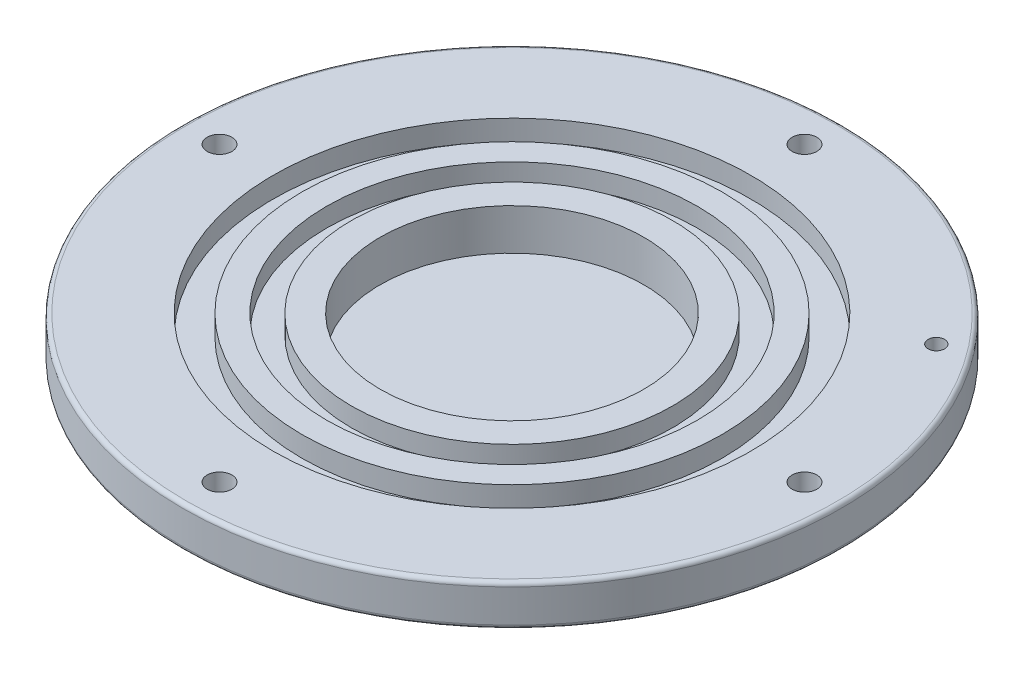
from build123d import *

# Parameters (mm, degrees)
SKETCH1_R            = 40
BOSS_EXTRUDE11_DEPTH = 5
SKETCH1_14_R         = 1.5
CUT_EXTRUDE5_DEPTH   = 57.789083458
OFFSETCIRCLE_R       = 22.5
BOSS_EXTRUDE14_DEPTH = 10
SKETCH1_15_R         = 22.5
SKETCH1_15_R_2       = 19.5
CUT_EXTRUDE6_DEPTH   = 2.3
SKETCH1_16_R         = 29
SKETCH1_16_R_2       = 25.5
CUT_EXTRUDE7_DEPTH   = 2.5
SKETCH10_R           = 1
CUT_EXTRUDE8_DEPTH   = 58.445626465
SKETCH1_17_R         = 16
CUT_EXTRUDE9_DEPTH   = 5
FILLET1_R            = 0.5
FILLET2_R            = 0.5
FILLET3_R            = 0.5


with BuildPart() as part:
    # Sketch1 → Boss-Extrude11 (new body)
    with BuildSketch(Plane(origin=(0, 0, 0), x_dir=(1, 0, 0), z_dir=(0, 1, 0))):
        Circle(SKETCH1_R)
    extrude(amount=-BOSS_EXTRUDE11_DEPTH)

    # Sketch1<14> → Cut-Extrude5 (cut, through all)
    with BuildSketch(Plane(origin=(0, 0, 0), x_dir=(1, 0, 0), z_dir=(0, 1, 0))):
        with Locations((35.5, 0)):
            Circle(SKETCH1_14_R)
        with Locations((0, -35.5)):
            Circle(SKETCH1_14_R)
        with Locations((-35.5, 0)):
            Circle(SKETCH1_14_R)
        with Locations((0, 35.5)):
            Circle(SKETCH1_14_R)
    extrude(amount=-CUT_EXTRUDE5_DEPTH, mode=Mode.SUBTRACT)

    # offsetCircle → Boss-Extrude14 (add)
    with BuildSketch(Plane(origin=(0, 0, 0), x_dir=(1, 0, 0), z_dir=(0, 1, 0))):
        Circle(OFFSETCIRCLE_R)
    extrude(amount=-BOSS_EXTRUDE14_DEPTH)

    # Sketch1<15> → Cut-Extrude6 (cut)
    with BuildSketch(Plane(origin=(0, 0, 0), x_dir=(1, 0, 0), z_dir=(0, 1, 0))):
        Circle(SKETCH1_15_R)
        Circle(SKETCH1_15_R_2, mode=Mode.SUBTRACT)
    extrude(amount=-CUT_EXTRUDE6_DEPTH, mode=Mode.SUBTRACT)

    # Sketch1<16> → Cut-Extrude7 (cut)
    with BuildSketch(Plane(origin=(0, 0, 0), x_dir=(1, 0, 0), z_dir=(0, 1, 0))):
        Circle(SKETCH1_16_R)
        Circle(SKETCH1_16_R_2, mode=Mode.SUBTRACT)
    extrude(amount=-CUT_EXTRUDE7_DEPTH, mode=Mode.SUBTRACT)

    # Sketch10 → Cut-Extrude8 (cut, through all)
    with BuildSketch(Plane(origin=(0, 0, 0), x_dir=(1, 0, 0), z_dir=(0, 1, 0))):
        with Locations((29, 22.5)):
            Circle(SKETCH10_R)
    extrude(amount=-CUT_EXTRUDE8_DEPTH, mode=Mode.SUBTRACT)

    # Sketch1<17> → Cut-Extrude9 (cut)
    with BuildSketch(Plane(origin=(0, 0, 0), x_dir=(1, 0, 0), z_dir=(0, 1, 0))):
        Circle(SKETCH1_17_R)
    extrude(amount=-CUT_EXTRUDE9_DEPTH, mode=Mode.SUBTRACT)

    # Fillet1
    fillet1_edges = [part.edges().sort_by_distance(p)[0] for p in [
        (-40, -5, 0),
    ]]
    fillet(fillet1_edges, radius=FILLET1_R)

    # Fillet2
    fillet2_edges = [part.edges().sort_by_distance(p)[0] for p in [
        (-40, 0, 0),
    ]]
    fillet(fillet2_edges, radius=FILLET2_R)

    # Fillet3
    fillet3_edges = [part.edges().sort_by_distance(p)[0] for p in [
        (-22.5, -10, 0),
    ]]
    fillet(fillet3_edges, radius=FILLET3_R)


solid = part.part
